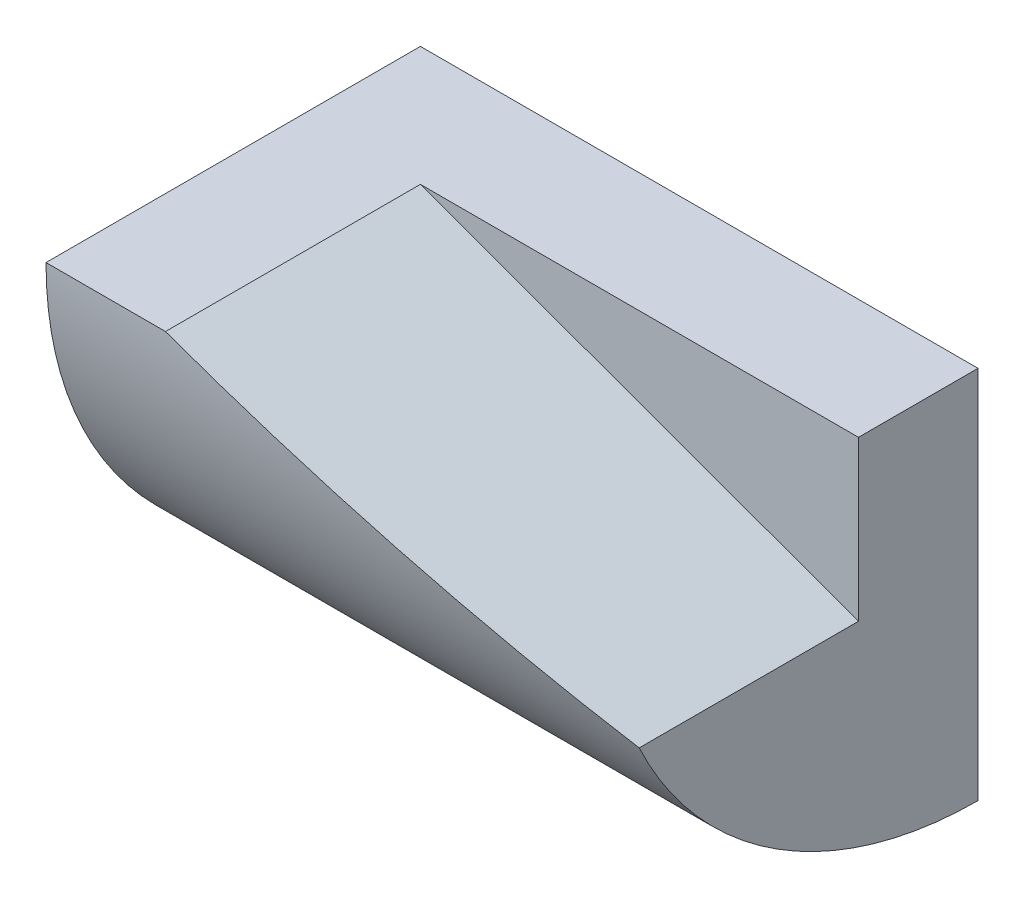
from build123d import *

# Parameters (mm, degrees)
BOSS_EXTRUDE1_DEPTH = 70
CUT_EXTRUDE2_DEPTH  = 32


with BuildPart() as part:
    # Sketch1 → Boss-Extrude1 (new body)
    with BuildSketch(Plane(origin=(0, 0, 0), x_dir=(0, 0, -1), z_dir=(1, 0, 0))):
        with BuildLine():
            Line((-47, 0), (0, 0))
            Line((0, 0), (0, -47))
            ThreePointArc((0, -47), (-33.234018716, -33.234018716), (-47, 0))
        make_face()
    extrude(amount=BOSS_EXTRUDE1_DEPTH)

    # Sketch3 → Cut-Extrude2 (cut)
    with BuildSketch(Plane(origin=(0, 0, 47), x_dir=(-1, 0, 0), z_dir=(0, 0, -1))):
        Polygon((-15, 0), (-70, -20), (-70, 0), align=None)
    extrude(amount=CUT_EXTRUDE2_DEPTH, mode=Mode.SUBTRACT)


solid = part.part
